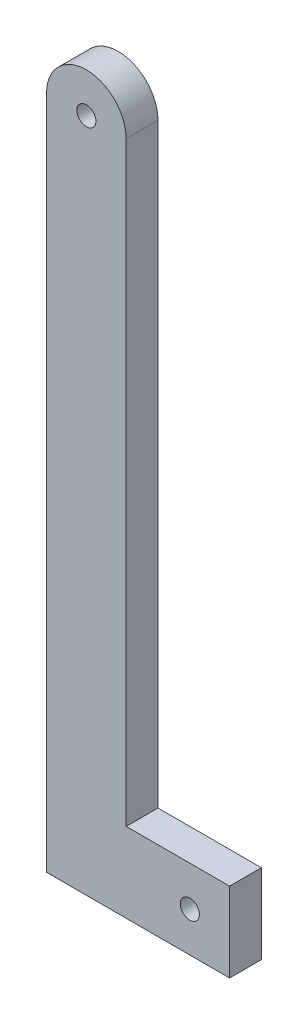
from build123d import *

# Parameters (mm, degrees)
SKETCH1_R           = 3
BOSS_EXTRUDE1_DEPTH = 10


with BuildPart() as part:
    # Sketch1 → Boss-Extrude1 (new body)
    with BuildSketch(Plane.XY):
        with BuildLine():
            Line((-12.5, 0), (-12.5, -212.108992783))
            Line((-12.5, -212.108992783), (45, -212.108992783))
            Line((45, -212.108992783), (45, -187.108992783))
            Line((45, -187.108992783), (12.5, -187.108992783))
            Line((12.5, -187.108992783), (12.5, 0))
            ThreePointArc((12.5, 0), (0, 12.5), (-12.5, 0))
        make_face()
        Circle(SKETCH1_R, mode=Mode.SUBTRACT)
        with Locations((32.5, -199.608992783)):
            Circle(SKETCH1_R, mode=Mode.SUBTRACT)
    extrude(amount=BOSS_EXTRUDE1_DEPTH)


solid = part.part
